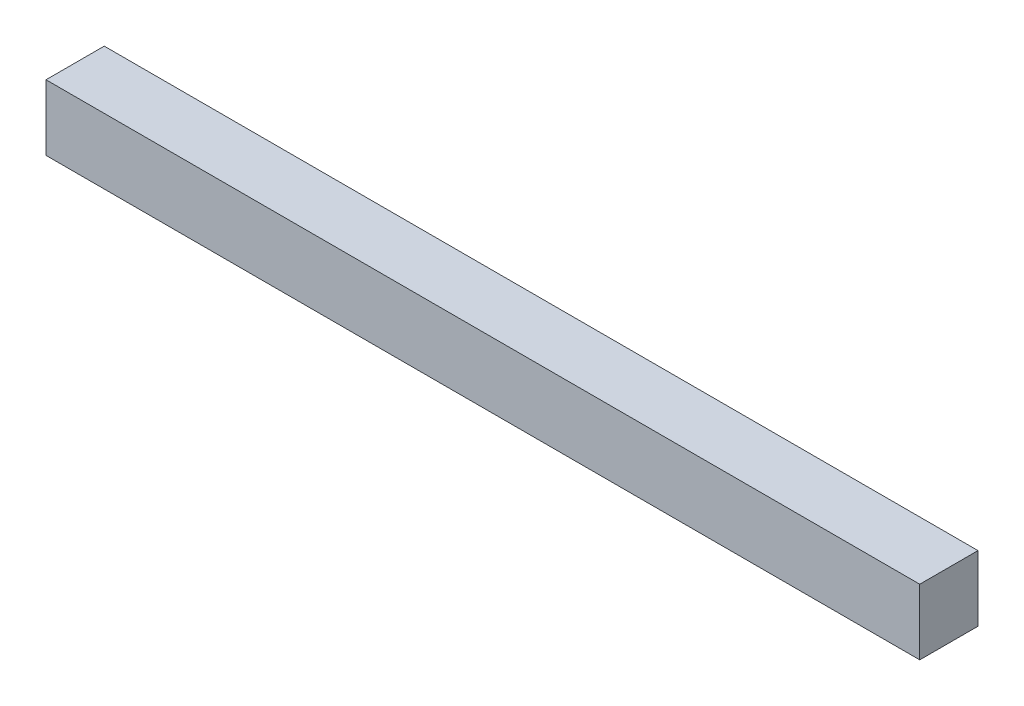
from build123d import *

# Parameters (mm, degrees)
ESQUISSE1_W      = 120
ESQUISSE1_H      = 9
EXTRUSION1_DEPTH = 8


with BuildPart() as part:
    # Esquisse1 → Extrusion1 (new body)
    with BuildSketch(Plane.XY):
        with Locations((26.659892568, 6.635894737)):
            Rectangle(ESQUISSE1_W, ESQUISSE1_H)
    extrude(amount=EXTRUSION1_DEPTH)


solid = part.part
